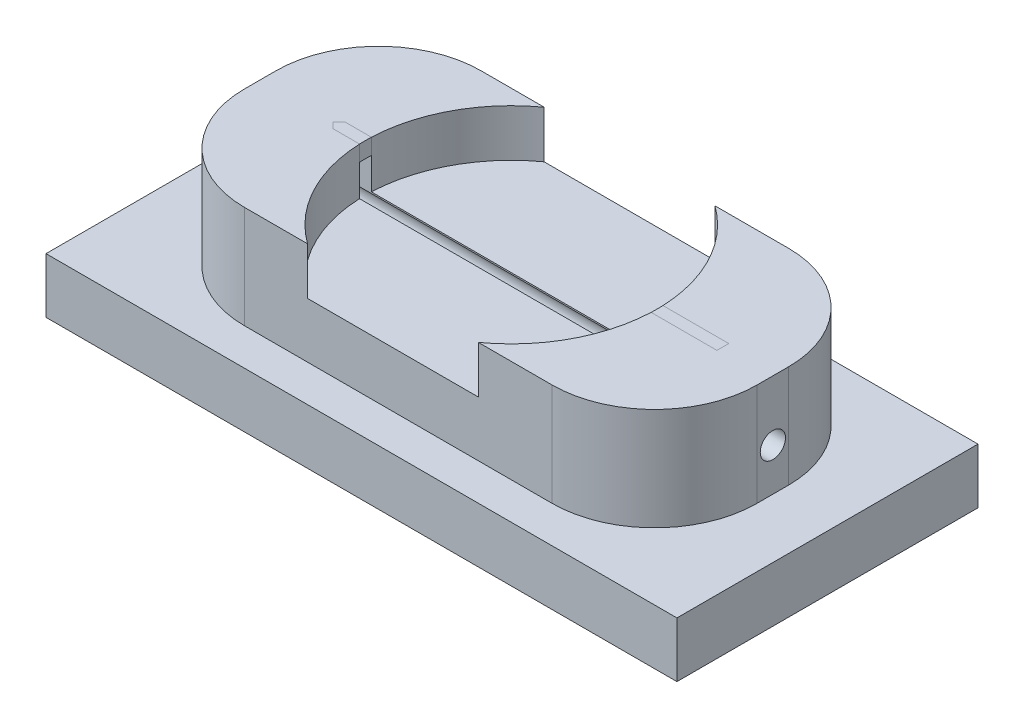
from build123d import *

# Parameters (mm, degrees)
SKETCH1_W                = 65
SKETCH1_H                = 30
BOSS_EXTRUDE1_DEPTH      = 58
CUT_EXTRUDE1_DEPTH       = 70
CUT_EXTRUDE2_DEPTH       = 89.396832522
CUT_EXTRUDE2_DEPTH_BACK  = 89.396832522
SKETCH3_R                = 1.6
FILLET1_R                = 13
SKETCH15_W               = 83.696095513
SKETCH15_H               = 31.69844841
CUT_EXTRUDE7_DEPTH       = 50
BOSS_EXTRUDE4_DEPTH      = 2
BOSS_EXTRUDE4_DEPTH_BACK = 5
SKETCH16_W               = 80
SKETCH16_H               = 38.173794917
SKETCH18_R               = 18.5
CUT_EXTRUDE8_DEPTH       = 6
BOSS_EXTRUDE5_DEPTH      = 2
BOSS_EXTRUDE5_2_DEPTH    = 2


with BuildPart() as part:
    # Sketch1 → Boss-Extrude1 (new body)
    with BuildSketch(Plane(origin=(0, 0, 0), x_dir=(1, 0, 0), z_dir=(0, 1, 0))):
        with Locations((7.5, 0)):
            Rectangle(SKETCH1_W, SKETCH1_H)
    extrude(amount=BOSS_EXTRUDE1_DEPTH)

    # Sketch2 → Cut-Extrude1 (cut)
    with BuildSketch(Plane(origin=(0, 58, 0), x_dir=(1, 0, 0), z_dir=(0, 1, 0))):
        Polygon((-15, 0.75), (15, 0.75), (33.657016573, 0.75), (33.657016573, -0.75), (15, -0.75), (-15, -0.75), (-15.75, 0), align=None)
    extrude(amount=-CUT_EXTRUDE1_DEPTH, mode=Mode.SUBTRACT)

    # Sketch3 → Cut-Extrude2 (cut, two sides: drawn at the far end of the back side and taken through both)
    with BuildSketch(Plane.ZY.offset(25).offset(-CUT_EXTRUDE2_DEPTH_BACK)):
        with Locations((0, 50.4)):
            Circle(SKETCH3_R)
    extrude(amount=CUT_EXTRUDE2_DEPTH + CUT_EXTRUDE2_DEPTH_BACK, mode=Mode.SUBTRACT)

    # Fillet1
    fillet1_edges = [part.edges().sort_by_distance(p)[0] for p in [
        (40, 29, 15),
        (-25, 29, 15),
        (-25, 29, -15),
        (40, 29, -15),
    ]]
    fillet(fillet1_edges, radius=FILLET1_R)

    # Sketch15 → Cut-Extrude7 (cut)
    with BuildSketch(Plane(origin=(0, -10, 0), x_dir=(-1, 0, 0), z_dir=(0, -1, 0))):
        with Locations((-0.057440767, 0.030479277)):
            Rectangle(SKETCH15_W, SKETCH15_H)
    extrude(amount=-CUT_EXTRUDE7_DEPTH, mode=Mode.SUBTRACT)

    # Sketch16 → Boss-Extrude4 (add, two sides: drawn at the far end of the back side and taken through both)
    with BuildSketch(Plane(origin=(0, 40, 0), x_dir=(-1, 0, 0), z_dir=(0, -1, 0)).offset(-BOSS_EXTRUDE4_DEPTH_BACK)):
        with Locations((-7.5, -0.575928298)):
            Rectangle(SKETCH16_W, SKETCH16_H)
    extrude(amount=BOSS_EXTRUDE4_DEPTH + BOSS_EXTRUDE4_DEPTH_BACK)

    # Sketch18 → Cut-Extrude8 (cut)
    with BuildSketch(Plane(origin=(0, 58, 0), x_dir=(1, 0, 0), z_dir=(0, 1, 0))):
        with Locations((6.828508286, 0)):
            Circle(SKETCH18_R)
    extrude(amount=-CUT_EXTRUDE8_DEPTH, mode=Mode.SUBTRACT)


with BuildPart() as body_2:
    # Sketch19 → Boss-Extrude5 (new body)
    with BuildSketch(Plane(origin=(0, 58, 0), x_dir=(1, 0, 0), z_dir=(0, 1, 0))):
        with BuildLine():
            Line((-11.656282759, 0.75), (-15, 0.75))
            Line((-15, 0.75), (-15.75, 0))
            Line((-15.75, 0), (-15, -0.75))
            Line((-15, -0.75), (-11.656282759, -0.75))
            ThreePointArc((-11.656282759, -0.75), (-11.671491714, 0), (-11.656282759, 0.75))
        make_face()
    extrude(amount=-BOSS_EXTRUDE5_DEPTH)


with BuildPart() as body_3:
    # Sketch19 → Boss-Extrude5 2 (new body)
    with BuildSketch(Plane(origin=(0, 58, 0), x_dir=(1, 0, 0), z_dir=(0, 1, 0))):
        with BuildLine():
            Line((25.313299332, 0.75), (33.657016573, 0.75))
            Line((33.657016573, 0.75), (33.657016573, -0.75))
            Line((33.657016573, -0.75), (25.313299332, -0.75))
            ThreePointArc((25.313299332, -0.75), (25.328508286, 0), (25.313299332, 0.75))
        make_face()
    extrude(amount=-BOSS_EXTRUDE5_2_DEPTH)


solid = Compound([part.part, body_2.part, body_3.part])
